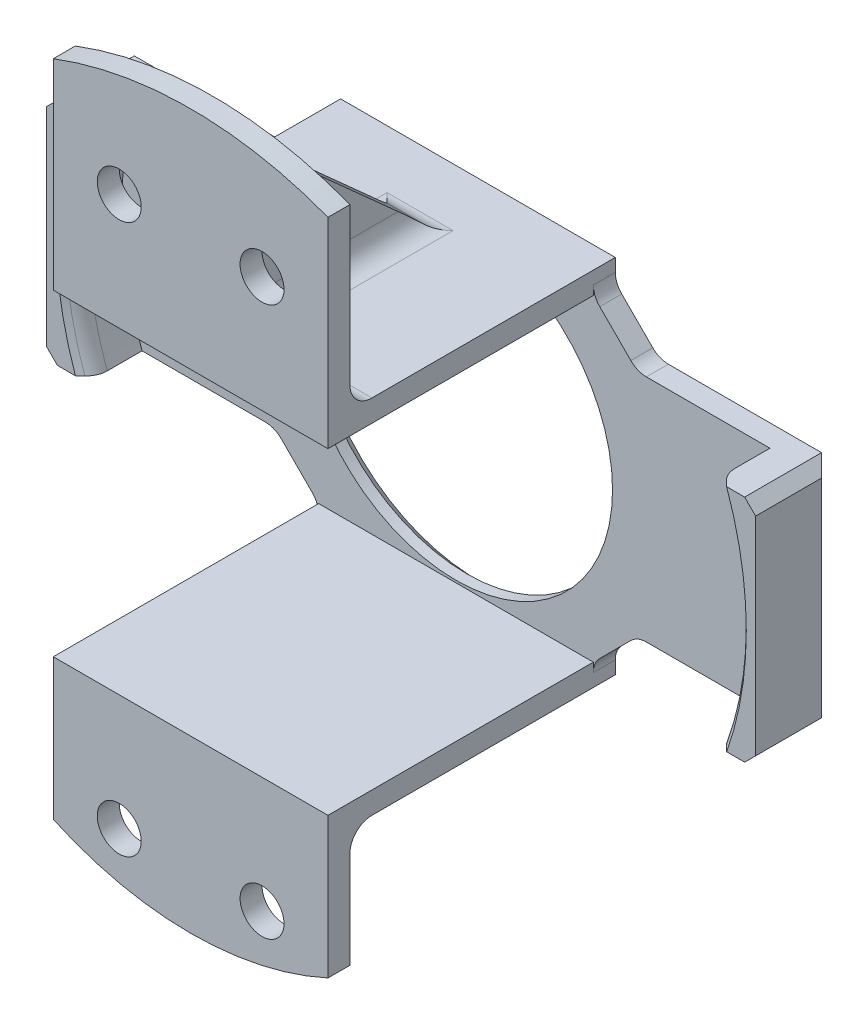
from build123d import *

# Parameters (mm, degrees)
BOSS_EXTRUDE1_DEPTH     = 12.5
SKETCH2_R               = 45
SKETCH2_R_2             = 35
CUT_EXTRUDE_THIN1_DEPTH = 10
CUT_EXTRUDE1_DEPTH      = 10
BOSS_EXTRUDE2_DEPTH     = 32.275
SKETCH5_R               = 14.25
CUT_EXTRUDE2_DEPTH      = 40
CHAMFER1_SIZE           = 5
CHAMFER2_SIZE           = 1
BOSS_EXTRUDE3_DEPTH     = 5
CHAMFER3_SIZE           = 5
FILLET1_R               = 3
RIB2_REACH              = 56.318
SKETCH7_WALL_W          = 134.965083932
SKETCH7_WALL_H          = 2
RIB3_REACH              = 56.318
SKETCH8_WALL_W          = 131.736112932
SKETCH8_WALL_H          = 2
CUT_EXTRUDE3_DEPTH      = 55.318487934
CHAMFER4_SIZE           = 1
SKETCH10_R              = 2
CUT_EXTRUDE4_DEPTH      = 5
CHAMFER5_SIZE           = 1
FILLET2_R               = 2


with BuildPart() as part:
    # Sketch1 → Boss-Extrude1 (new, symmetric)
    with BuildSketch(Plane(origin=(0, 0, 0), x_dir=(0, 0, -1), z_dir=(1, 0, 0))):
        Polygon((0, 35), (0, 14.45), (24.15, 14.45), (24.15, -14.45), (0, -14.45), (0, -35), (2, -35), (2, -16.45), (26.15, -16.45), (26.15, 16.45), (2, 16.45), (2, 35), align=None)
    extrude(amount=BOSS_EXTRUDE1_DEPTH, both=True)

    # Sketch2 → Cut-Extrude-Thin1 (cut)
    with BuildSketch(Plane.XY):
        Circle(SKETCH2_R)
        Circle(SKETCH2_R_2, mode=Mode.SUBTRACT)
    extrude(amount=-CUT_EXTRUDE_THIN1_DEPTH, mode=Mode.SUBTRACT)

    # Sketch3 → Cut-Extrude1 (cut)
    with BuildSketch(Plane.XY):
        with BuildLine():
            Line((12.5, -32.691742077), (12.5, -27.271780287))
            ThreePointArc((12.5, -27.271780287), (0, -30), (-12.5, -27.271780287))
            Line((-12.5, -27.271780287), (-12.5, -32.691742077))
            ThreePointArc((-12.5, -32.691742077), (0, -35), (12.5, -32.691742077))
        make_face()
    extrude(amount=-CUT_EXTRUDE1_DEPTH, mode=Mode.SUBTRACT)

    # Sketch4 → Boss-Extrude2 (add, symmetric)
    with BuildSketch(Plane(origin=(0, 0, 0), x_dir=(0, 0, -1), z_dir=(1, 0, 0))):
        Polygon((14.075, 16.45), (14.075, 14.45), (24.15, 14.45), (24.15, -14.45), (14.075, -14.45), (14.075, -16.45), (26.15, -16.45), (26.15, 16.45), align=None)
    extrude(amount=BOSS_EXTRUDE2_DEPTH, both=True)

    # Sketch5 → Cut-Extrude2 (cut)
    with BuildSketch(Plane(origin=(0, 0, -26.15), x_dir=(-1, 0, 0), z_dir=(0, 0, -1))):
        Circle(SKETCH5_R)
    extrude(amount=-CUT_EXTRUDE2_DEPTH, mode=Mode.SUBTRACT)

    # Chamfer1
    chamfer1_edges = [part.edges().sort_by_distance(p)[0] for p in [
        (12.5, -15.45, -14.075),
        (-12.5, -15.45, -14.075),
        (12.5, 15.45, -14.075),
        (-12.5, 15.45, -14.075),
    ]]
    chamfer(chamfer1_edges, length=CHAMFER1_SIZE)

    # Chamfer2
    chamfer2_edges = [part.edges().sort_by_distance(p)[0] for p in [
        (14.25, 0, -26.15),
    ]]
    chamfer(chamfer2_edges, length=CHAMFER2_SIZE)

    # Sketch6 → Boss-Extrude3 (add)
    with BuildSketch(Plane.XY.offset(-24.15)):
        with BuildLine():
            Line((-32.275, -14.45), (-32.275, 14.45))
            Line((-32.275, 14.45), (-26.774579829, 14.45))
            ThreePointArc((-26.774579829, 14.45), (-30.425, 0), (-26.774579829, -14.45))
            Line((-26.774579829, -14.45), (-32.275, -14.45))
        make_face()
        with BuildLine():
            Line((32.275, -14.45), (26.774579829, -14.45))
            ThreePointArc((26.774579829, -14.45), (30.425, 0), (26.774579829, 14.45))
            Line((26.774579829, 14.45), (32.275, 14.45))
            Line((32.275, 14.45), (32.275, -14.45))
        make_face()
    extrude(amount=BOSS_EXTRUDE3_DEPTH)

    # Chamfer3
    chamfer3_edges = [part.edges().sort_by_distance(p)[0] for p in [
        (-32.275, 16.45, -20.1125),
        (-32.275, -16.45, -20.1125),
        (32.275, -16.45, -20.1125),
        (32.275, 16.45, -20.1125),
    ]]
    chamfer(chamfer3_edges, length=CHAMFER3_SIZE)

    # Fillet1
    fillet1_edges = [part.edges().sort_by_distance(p)[0] for p in [
        (-28.024789914, -14.45, -19.15),
        (28.024789914, -14.45, -19.15),
        (28.024789914, 14.45, -19.15),
        (-28.024789914, 14.45, -19.15),
    ]]
    fillet(fillet1_edges, radius=FILLET1_R)

    # Sketch7 wall → Rib2 (add, up to next)
    with BuildSketch(Plane(origin=(0, 24.570871039, -11.05625), x_dir=(0, -0.667612213603, -0.744509188827), z_dir=(0, 0.744509188827, -0.667612213603)), mode=Mode.PRIVATE) as rib2_sk1:
        Rectangle(SKETCH7_WALL_W, SKETCH7_WALL_H)
    rib2_tool1 = extrude(rib2_sk1.sketch, amount=-RIB2_REACH, mode=Mode.PRIVATE) - part.part
    add(rib2_tool1.solids().sort_by_distance((0, 24.570871039, -11.05625))[0])

    # Sketch8 wall → Rib3 (add, up to next)
    with BuildSketch(Plane(origin=(0, -21.860890144, -11.05625), x_dir=(0, -0.512901558692, 0.858447430593), z_dir=(0, -0.858447430593, -0.512901558692)), mode=Mode.PRIVATE) as rib3_sk1:
        Rectangle(SKETCH8_WALL_W, SKETCH8_WALL_H)
    rib3_tool1 = extrude(rib3_sk1.sketch, amount=-RIB3_REACH, mode=Mode.PRIVATE) - part.part
    add(rib3_tool1.solids().sort_by_distance((0, -21.860890144, -11.05625))[0])

    # Sketch9 → Cut-Extrude3 (cut, through all)
    with BuildSketch(Plane(origin=(0, 0, -26.15), x_dir=(-1, 0, 0), z_dir=(0, 0, -1))):
        Polygon((12.5, 14.45), (12.5, 16.45), (27.275, 16.45), (32.275, 11.45), (32.275, 10.45), (16.5, 10.45), align=None)
        Polygon((-27.275, 16.45), (-32.275, 11.45), (-32.275, 10.45), (-16.5, 10.45), (-12.5, 14.45), (-12.5, 16.45), align=None)
        Polygon((27.275, -16.45), (32.275, -11.45), (32.275, -10.45), (16.5, -10.45), (12.5, -14.45), (12.5, -16.45), align=None)
        Polygon((-12.5, -14.45), (-12.5, -16.45), (-27.275, -16.45), (-32.275, -11.45), (-32.275, -10.45), (-16.5, -10.45), align=None)
    extrude(amount=-CUT_EXTRUDE3_DEPTH, mode=Mode.SUBTRACT)

    # Chamfer4
    chamfer4_edges = [part.edges().sort_by_distance(p)[0] for p in [
        (30.425, 0, -19.15),
        (-30.425, 0, -19.15),
    ]]
    chamfer(chamfer4_edges, length=CHAMFER4_SIZE)

    # Sketch10 → Cut-Extrude4 (cut)
    with BuildSketch(Plane(origin=(0, 0, -2), x_dir=(-1, 0, 0), z_dir=(0, 0, -1))):
        with Locations((6.5, 25)):
            Circle(SKETCH10_R)
        with Locations((-6.5, 25)):
            Circle(SKETCH10_R)
        with Locations((-6.5, -25)):
            Circle(SKETCH10_R)
        with Locations((6.5, -25)):
            Circle(SKETCH10_R)
    extrude(amount=-CUT_EXTRUDE4_DEPTH, mode=Mode.SUBTRACT)

    # Chamfer5
    chamfer5_edges = [part.edges().sort_by_distance(p)[0] for p in [
        (-32.275, 10.45, -22.65),
        (32.275, 10.45, -22.65),
        (-32.275, 0, -26.15),
        (-32.275, -10.45, -22.65),
        (32.275, 0, -26.15),
        (32.275, -10.45, -22.65),
    ]]
    chamfer(chamfer5_edges, length=CHAMFER5_SIZE)

    # Fillet2
    fillet2_edges = [part.edges().sort_by_distance(p)[0] for p in [
        (-30.425, 0, -20.15),
        (30.425, 0, -20.15),
        (12.5, 14.45, -25.15),
        (-12.5, 14.45, -25.15),
        (-12.5, -14.45, -25.15),
        (12.5, -14.45, -25.15),
        (16.5, -10.45, -25.15),
        (16.5, 10.45, -25.15),
        (-16.5, 10.45, -25.15),
        (-16.5, -10.45, -25.15),
        (6.75, -16.45, -2),
        (-6.75, -16.45, -2),
        (-6.75, 16.45, -2),
        (6.75, 16.45, -2),
        (0, -27.271780287, -2),
        (0, 32.691742077, -2),
        (0, 16.45, -20.112500001),
        (0, -16.45, -20.112500001),
        (1, -21.860890144, -2),
        (1, -16.45, -11.05625),
        (-1, -21.860890144, -2),
        (-1, -16.45, -11.05625),
        (-1, 24.570871039, -2),
        (-1, 16.45, -11.05625),
        (1, 24.570871039, -2),
        (1, 16.45, -11.05625),
    ]]
    fillet(fillet2_edges, radius=FILLET2_R)


solid = part.part
